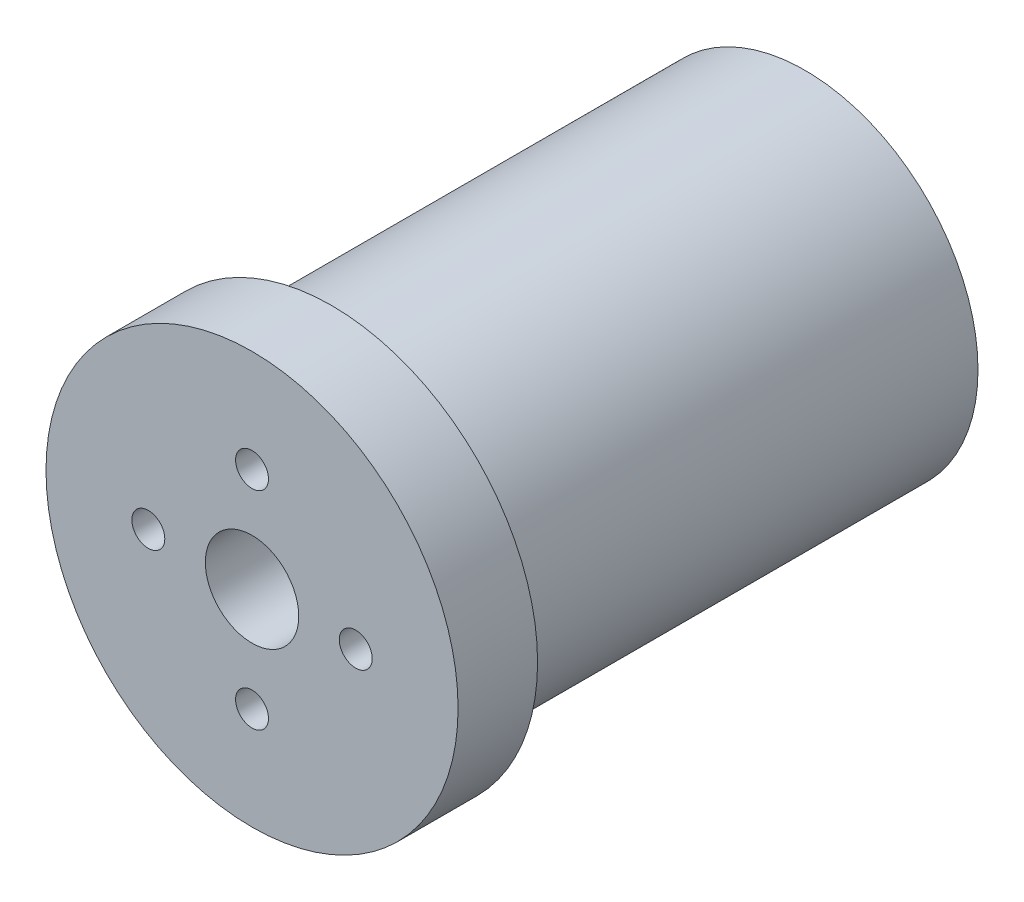
from build123d import *

# Parameters (mm, degrees)
SKETCH1_R           = 12.5
SKETCH1_R_2         = 1.190625
SKETCH1_R_3         = 3.3782
BOSS_EXTRUDE1_DEPTH = 40
SKETCH2_W           = 7.5
SKETCH2_H           = 24
SKETCH2_W_2         = 2.4
SKETCH2_H_2         = 5.75


with BuildPart() as part:
    # Sketch1 → Boss-Extrude1 (new body)
    with BuildSketch(Plane(origin=(0, 0, 0), x_dir=(0, 1, 0), z_dir=(0, 0, 1))):
        with Locations(Location((0, 0, 0), (0, 0, 270))):
            Circle(SKETCH1_R)
        with Locations(Location((0, -7.5, 0), (0, 0, 270))):
            Circle(SKETCH1_R_2, mode=Mode.SUBTRACT)
        with Locations(Location((7.5, 0, 0), (0, 0, 270))):
            Circle(SKETCH1_R_2, mode=Mode.SUBTRACT)
        with Locations(Location((-7.5, 0, 0), (0, 0, 270))):
            Circle(SKETCH1_R_2, mode=Mode.SUBTRACT)
        with Locations(Location((0, 7.5, 0), (0, 0, 270))):
            Circle(SKETCH1_R_2, mode=Mode.SUBTRACT)
        with Locations(Location((0, 0, 0), (0, 0, 270))):
            Circle(SKETCH1_R_3, mode=Mode.SUBTRACT)
    extrude(amount=BOSS_EXTRUDE1_DEPTH)

    # Sketch2 → Revolve1 (revolve)
    with BuildSketch(Plane.YZ, mode=Mode.PRIVATE) as revolve1_sk:
        with Locations((-8.75, 20)):
            Rectangle(SKETCH2_W, SKETCH2_H)
        with Locations((-13.7, 37.125)):
            Rectangle(SKETCH2_W_2, SKETCH2_H_2)
    revolve(revolve1_sk.sketch.rotate(Axis((0, 0, 0), (0, 0, 1)), 270), axis=Axis((0, 0, 0), (0, 0, 1)))


solid = part.part
